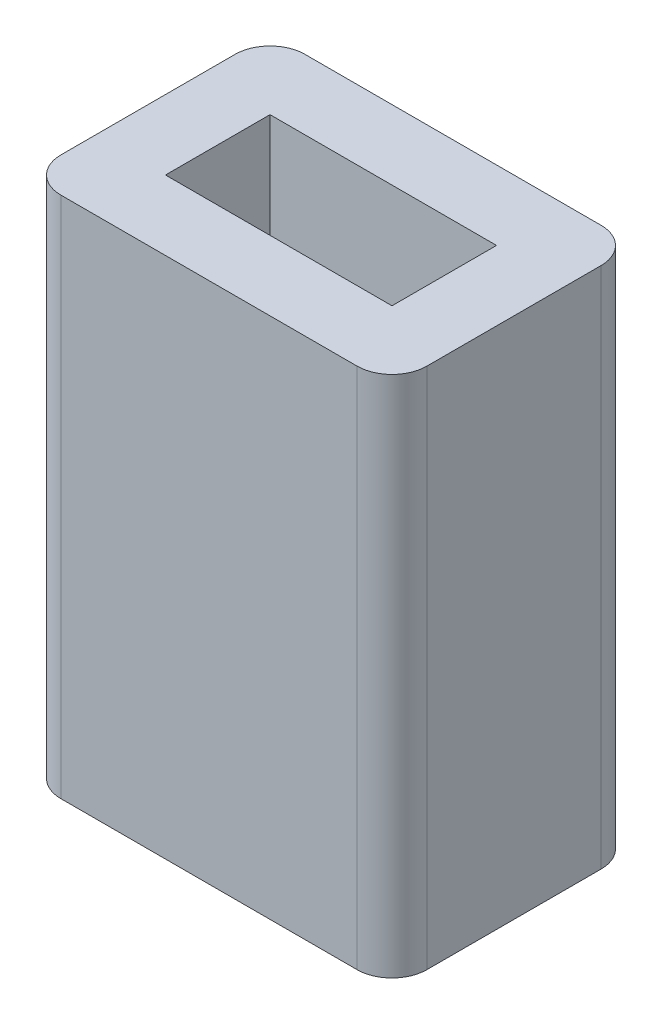
from build123d import *

# Parameters (mm, degrees)
SKETCH2_W           = 10.5
SKETCH2_H           = 7
SKETCH2_W_2         = 6.5
SKETCH2_H_2         = 3
BOSS_EXTRUDE1_DEPTH = 15
FILLET1_R           = 1


with BuildPart() as part:
    # Sketch2 → Boss-Extrude1 (new body)
    with BuildSketch(Plane(origin=(0, 0, 0), x_dir=(1, 0, 0), z_dir=(0, 1, 0))):
        Rectangle(SKETCH2_W, SKETCH2_H)
        Rectangle(SKETCH2_W_2, SKETCH2_H_2, mode=Mode.SUBTRACT)
    extrude(amount=BOSS_EXTRUDE1_DEPTH)

    # Fillet1
    fillet1_edges = [part.edges().sort_by_distance(p)[0] for p in [
        (-5.25, 7.5, 3.5),
        (-5.25, 7.5, -3.5),
        (5.25, 7.5, -3.5),
        (5.25, 7.5, 3.5),
    ]]
    fillet(fillet1_edges, radius=FILLET1_R)


solid = part.part
